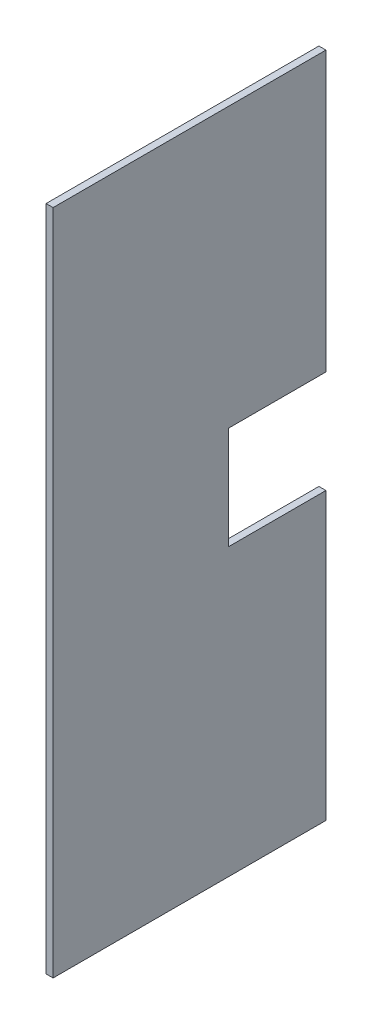
from build123d import *

# Parameters (mm, degrees)
SKETCH_1_W          = 95
SKETCH_1_H          = 38.85
EXTRUDE_1_DEPTH     = 0.5
SKETCH_2_W          = 38.85
SKETCH_2_H          = 95
EXTRUDE_2_DEPTH     = 0.5
CUT_EXTRUDE_1_DEPTH = 110.347085009


with BuildPart() as part:
    # Эскиз1 → Бобышка-Вытянуть1 (new body)
    with BuildSketch(Plane(origin=(0.5, 0, 0), x_dir=(0, -1, 0), z_dir=(-1, 0, 0))):
        with Locations((-53.35, 22.825)):
            Rectangle(SKETCH_1_W, SKETCH_1_H)
    extrude(amount=-EXTRUDE_1_DEPTH)

    # Эскиз2 → Бобышка-Вытянуть2 (add)
    with BuildSketch(Plane.ZY.offset(-0.5)):
        with Locations((22.825, 53.35)):
            Rectangle(SKETCH_2_W, SKETCH_2_H)
    extrude(amount=EXTRUDE_2_DEPTH)

    # Эскиз3 → Вырез-Вытянуть1 (cut, through all)
    with BuildSketch(Plane.ZY):
        Polygon((-5.326732783, 46.541852111), (17.306560977, 46.5418531), (17.306560338, 61.155899742), (-5.326732783, 61.155898752), align=None)
    extrude(amount=-CUT_EXTRUDE_1_DEPTH, mode=Mode.SUBTRACT)


solid = part.part
